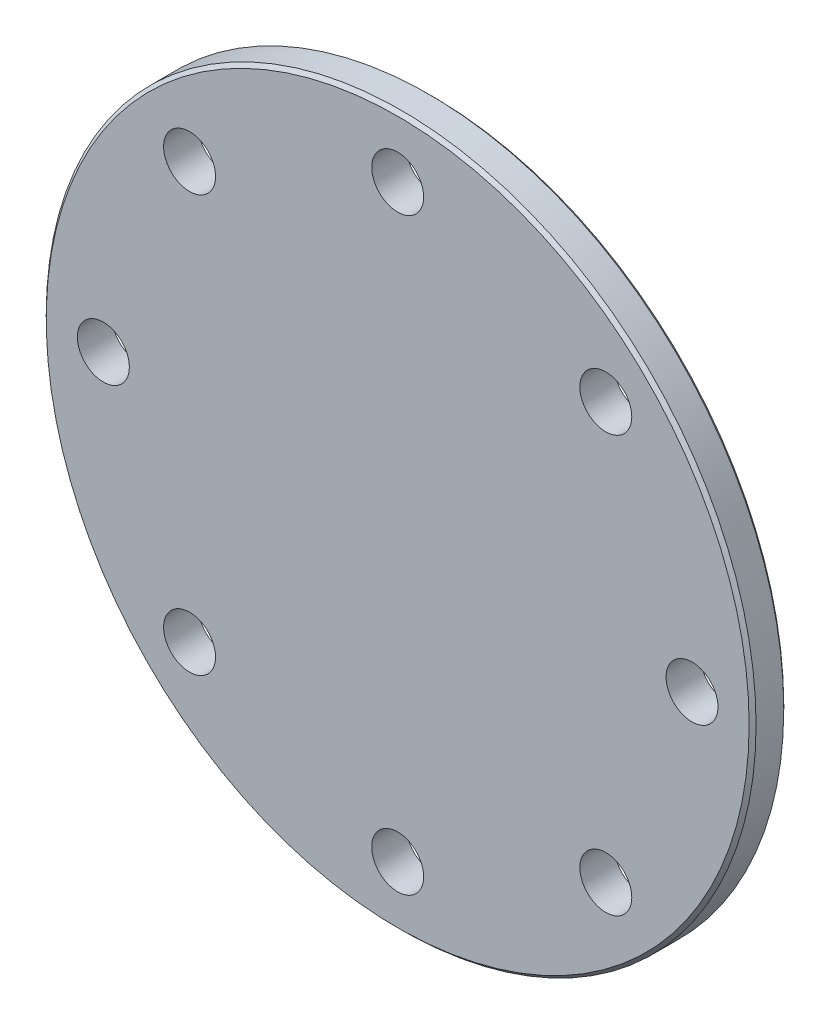
from build123d import *

# Parameters (mm, degrees)
SKETCH1_R           = 205
SKETCH1_R_2         = 15
BOSS_EXTRUDE1_DEPTH = 20
CHAMFER1_SIZE       = 2


with BuildPart() as part:
    # Sketch1 → Boss-Extrude1 (new body)
    with BuildSketch(Plane.XY):
        Circle(SKETCH1_R)
        with Locations((0, 170)):
            Circle(SKETCH1_R_2, mode=Mode.SUBTRACT)
        with Locations((120.208152802, 120.208152802)):
            Circle(SKETCH1_R_2, mode=Mode.SUBTRACT)
        with Locations((170, 0)):
            Circle(SKETCH1_R_2, mode=Mode.SUBTRACT)
        with Locations((120.208152802, -120.208152802)):
            Circle(SKETCH1_R_2, mode=Mode.SUBTRACT)
        with Locations((0, -170)):
            Circle(SKETCH1_R_2, mode=Mode.SUBTRACT)
        with Locations((-120.208152802, -120.208152802)):
            Circle(SKETCH1_R_2, mode=Mode.SUBTRACT)
        with Locations((-170, 0)):
            Circle(SKETCH1_R_2, mode=Mode.SUBTRACT)
        with Locations((-120.208152802, 120.208152802)):
            Circle(SKETCH1_R_2, mode=Mode.SUBTRACT)
    extrude(amount=BOSS_EXTRUDE1_DEPTH)

    # Chamfer1
    chamfer1_edges = [part.edges().sort_by_distance(p)[0] for p in [
        (-205, 0, 0),
        (-205, 0, 20),
    ]]
    chamfer(chamfer1_edges, length=CHAMFER1_SIZE)


solid = part.part
